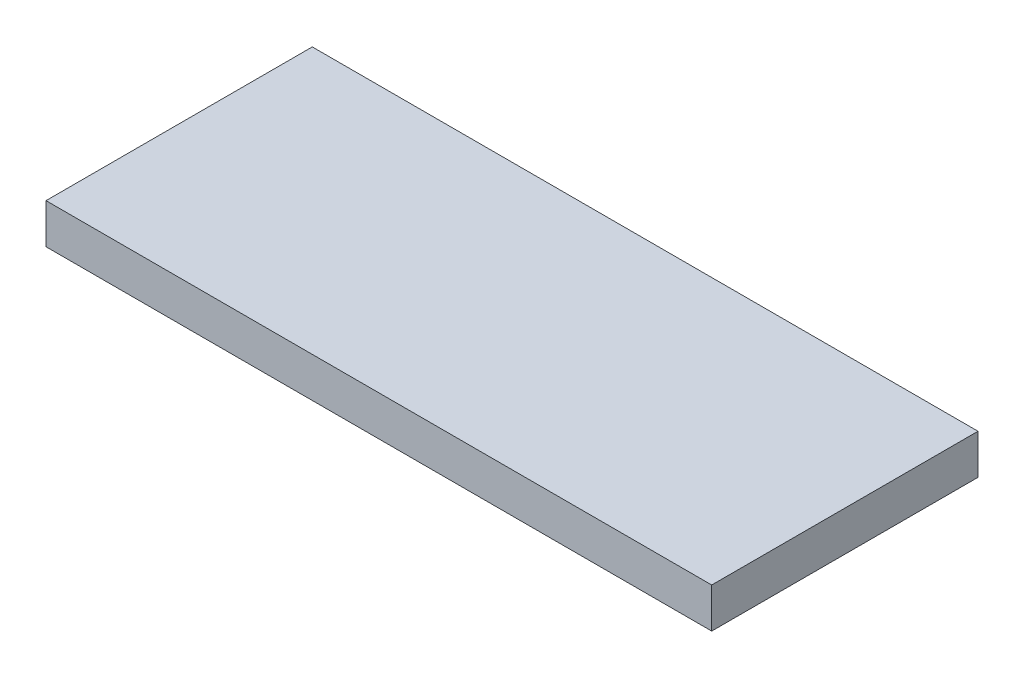
from build123d import *

# Parameters (mm, degrees)
SKETCH_1_W      = 50
SKETCH_1_H      = 20
EXTRUDE_1_DEPTH = 3


with BuildPart() as part:
    # 草图1 → 凸台-拉伸1 (new body)
    with BuildSketch(Plane(origin=(0, 0, 0), x_dir=(1, 0, 0), z_dir=(0, 1, 0))):
        Rectangle(SKETCH_1_W, SKETCH_1_H)
    extrude(amount=EXTRUDE_1_DEPTH)


solid = part.part
